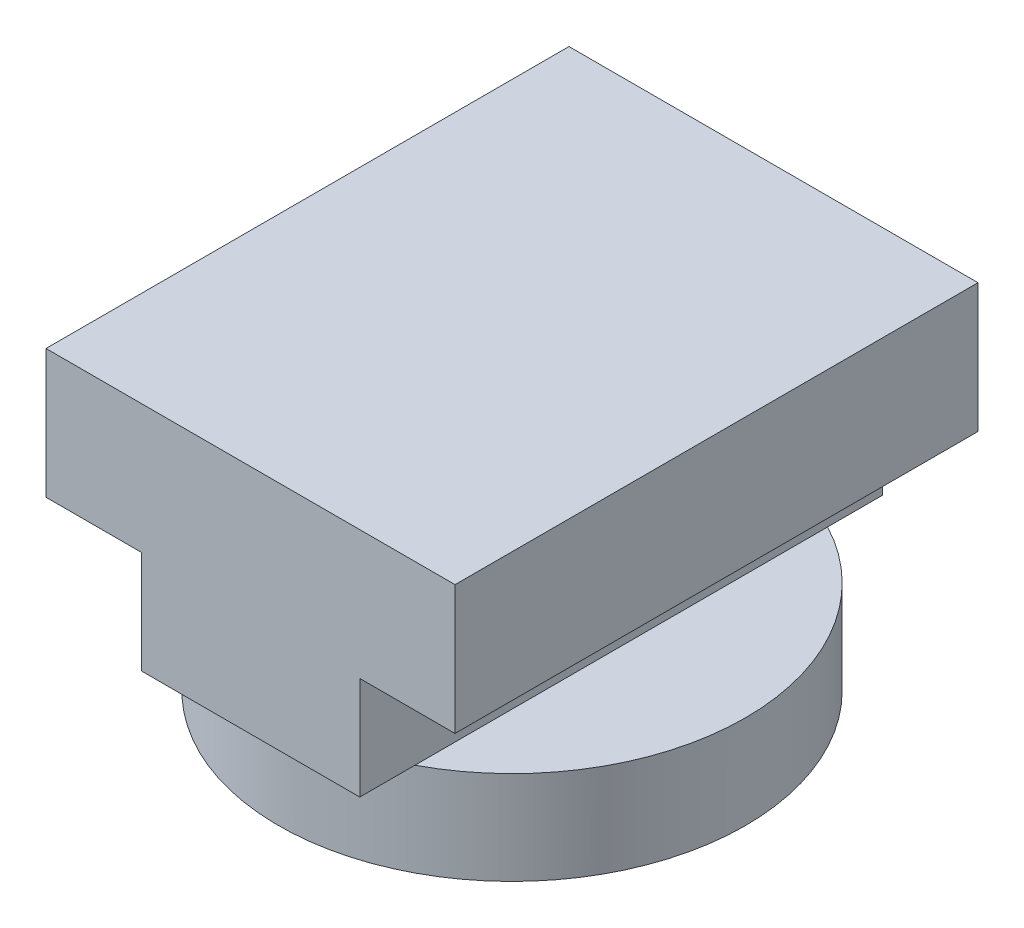
from build123d import *

# Parameters (mm, degrees)
BOSS_EXTRUDE1_DEPTH = 28
SKETCH3_R           = 12.5
BOSS_EXTRUDE2_DEPTH = 5


with BuildPart() as part:
    # Sketch1 → Boss-Extrude1 (new body)
    with BuildSketch(Plane.XY):
        Polygon((5.85, 0), (5.85, -5.5), (-5.85, -5.5), (-5.85, 0), (-10.95, 0), (-10.95, 6.9), (10.95, 6.9), (10.95, 0), align=None)
    extrude(amount=-BOSS_EXTRUDE1_DEPTH)

    # Sketch3 → Boss-Extrude2 (add)
    with BuildSketch(Plane.XZ.offset(5.5)):
        with Locations(Location((0, -14, 0), (0, 0, 62.095449663))):
            Circle(SKETCH3_R)
    extrude(amount=BOSS_EXTRUDE2_DEPTH)


solid = part.part
